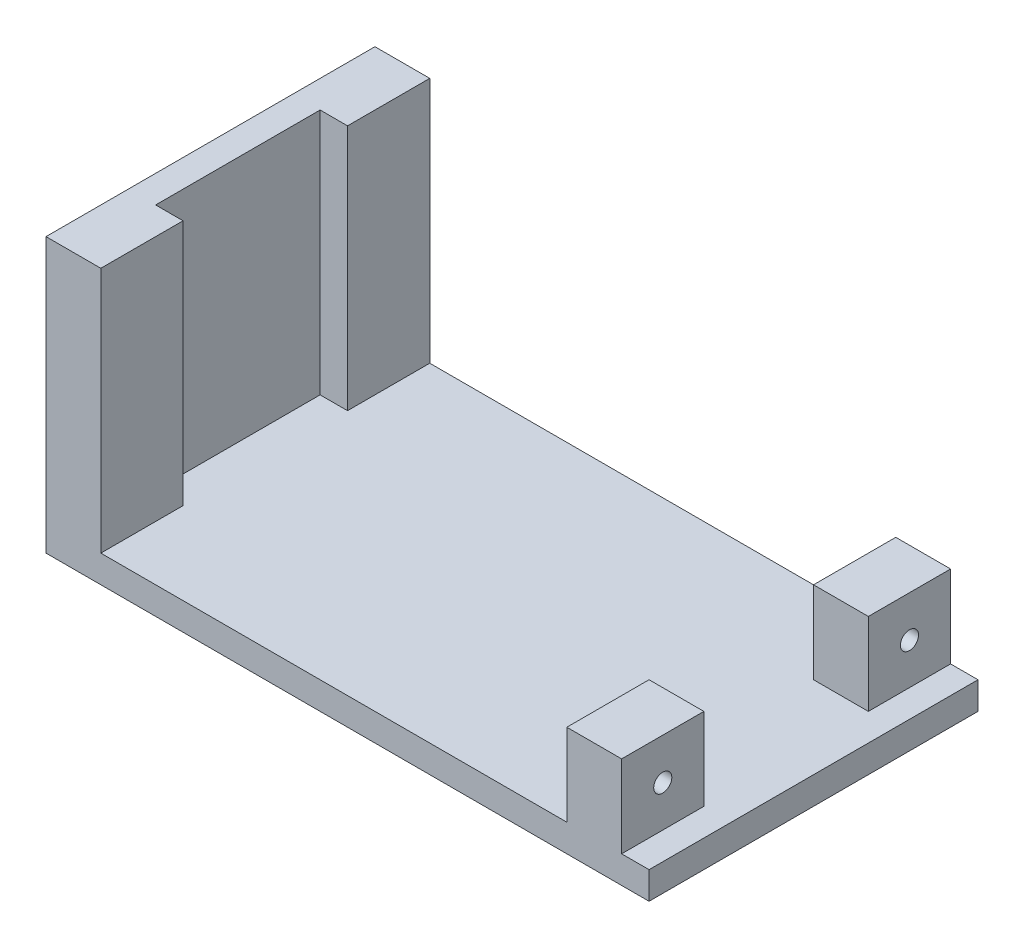
from build123d import *

# Parameters (mm, degrees)
CROQUIS1_W                = 110
CROQUIS1_H                = 60
SALIENTE_EXTRUIR1_DEPTH   = 5
SALIENTE_EXTRUIR2_DEPTH   = 45
CROQUIS4_W                = 15
CROQUIS4_H                = 15
SALIENTE_EXTRUIR3_DEPTH   = 15
CROQUIS5_W                = 15
CROQUIS5_H                = 15
CORTAR_EXTRUIR1_DEPTH     = 5
TALADRO_ROSCADO_M41_D     = 3.3
TALADRO_ROSCADO_M41_DEPTH = 14.008579979
TALADRO_ROSCADO_M41_TIP   = 0.991420021
CROQUIS11_W               = 5
CROQUIS11_H               = 4
SALIENTE_EXTRUIR4_DEPTH   = 3
CROQUIS12_W               = 40
CROQUIS12_H               = 4
SALIENTE_EXTRUIR5_DEPTH   = 2


with BuildPart() as part:
    # Croquis1 → Saliente-Extruir1 (new body)
    with BuildSketch(Plane(origin=(0, 0, 0), x_dir=(1, 0, 0), z_dir=(0, 1, 0))):
        with Locations((55, 30)):
            Rectangle(CROQUIS1_W, CROQUIS1_H)
    extrude(amount=SALIENTE_EXTRUIR1_DEPTH)

    # Croquis2 → Saliente-Extruir2 (add)
    with BuildSketch(Plane(origin=(0, 5, 0), x_dir=(1, 0, 0), z_dir=(0, 1, 0))):
        Polygon((0, 0), (10, 0), (10, 15), (5, 15), (5, 45), (10, 45), (10, 60), (0, 60), align=None)
    extrude(amount=SALIENTE_EXTRUIR2_DEPTH)

    # Croquis4 → Saliente-Extruir3 (add)
    with BuildSketch(Plane(origin=(0, 5, 0), x_dir=(1, 0, 0), z_dir=(0, 1, 0))):
        with Locations((102.5, 52.5)):
            Rectangle(CROQUIS4_W, CROQUIS4_H)
        with Locations((102.5, 7.5)):
            Rectangle(CROQUIS4_W, CROQUIS4_H)
    extrude(amount=SALIENTE_EXTRUIR3_DEPTH)

    # Croquis5 → Cortar-Extruir1 (cut)
    with BuildSketch(Plane(origin=(110, 0, 0), x_dir=(0, 0, -1), z_dir=(1, 0, 0))):
        with Locations((7.5, 12.5)):
            Rectangle(CROQUIS5_W, CROQUIS5_H)
        with Locations((52.5, 12.5)):
            Rectangle(CROQUIS5_W, CROQUIS5_H)
    extrude(amount=-CORTAR_EXTRUIR1_DEPTH, mode=Mode.SUBTRACT)

    # Taladro roscado M41
    with Locations(Plane(origin=(105, 0, 0), x_dir=(0, 0, -1), z_dir=(1, 0, 0))):
        with Locations((7.5, 12.5), (52.5, 12.5)):
            Hole(TALADRO_ROSCADO_M41_D / 2, depth=TALADRO_ROSCADO_M41_DEPTH)
            with Locations((0, 0, -(TALADRO_ROSCADO_M41_DEPTH + TALADRO_ROSCADO_M41_TIP / 2))):  # 118° drill point
                Cone(0, TALADRO_ROSCADO_M41_D / 2, TALADRO_ROSCADO_M41_TIP, mode=Mode.SUBTRACT)

    # Croquis11 → Saliente-Extruir4 (add)
    with BuildSketch(Plane.ZY):
        with Locations((-47.5, 32)):
            Rectangle(CROQUIS11_W, CROQUIS11_H)
        with Locations((-12.5, 32)):
            Rectangle(CROQUIS11_W, CROQUIS11_H)
    extrude(amount=SALIENTE_EXTRUIR4_DEPTH)

    # Croquis12 → Saliente-Extruir5 (add)
    with BuildSketch(Plane.ZY.offset(3)):
        with Locations((-30, 32)):
            Rectangle(CROQUIS12_W, CROQUIS12_H)
    extrude(amount=SALIENTE_EXTRUIR5_DEPTH)


solid = part.part
